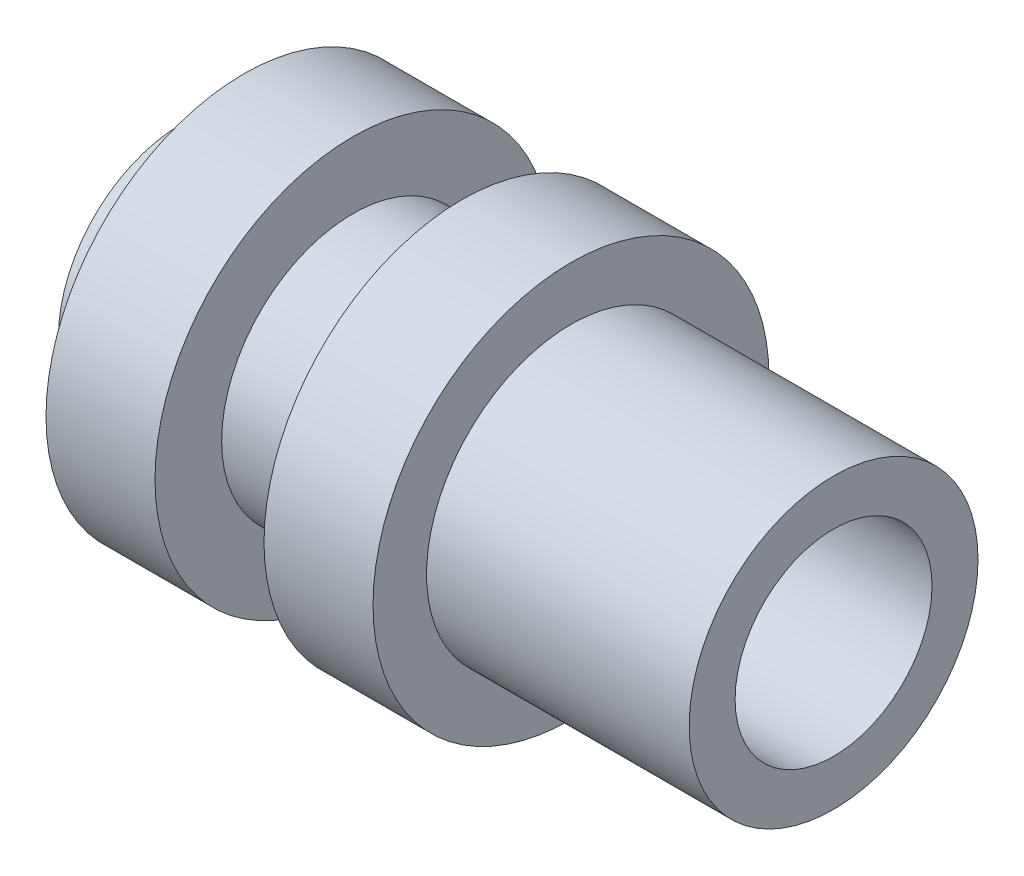
from build123d import *

# Parameters (mm, degrees)
SKETCH1_R           = 15.07617
BOSS_EXTRUDE1_DEPTH = 24.9071592
SKETCH2_R           = 9.3853
SKETCH2_R_2         = 4.5847
BOSS_EXTRUDE2_DEPTH = 4.7498
SKETCH3_R           = 7.5
CUT_EXTRUDE1_DEPTH  = 18.75
BOSS_EXTRUDE3_START = 20
SKETCH4_R           = 11
SKETCH4_R_2         = 7.5
BOSS_EXTRUDE3_DEPTH = 20
CUT_EXTRUDE4_START  = -8.3023864
SKETCH5_R           = 15.07617
SKETCH5_R_2         = 10
CUT_EXTRUDE4_DEPTH  = 8.3023864


with BuildPart() as part:
    # Sketch1 → Boss-Extrude1 (new body)
    with BuildSketch(Plane(origin=(0, 0, 0), x_dir=(0, 0, -1), z_dir=(1, 0, 0))):
        with Locations(Location((0, 0, 0), (0, 0, 180))):
            Circle(SKETCH1_R)
    extrude(amount=BOSS_EXTRUDE1_DEPTH)

    # Sketch2 → Boss-Extrude2 (add)
    with BuildSketch(Plane.ZY):
        with Locations(Location((0, 0, 0), (0, 0, 180))):
            Circle(SKETCH2_R)
        Circle(SKETCH2_R_2, mode=Mode.SUBTRACT)
    extrude(amount=BOSS_EXTRUDE2_DEPTH)

    # Sketch3 → Cut-Extrude1 (cut)
    with BuildSketch(Plane(origin=(24.9071592, 0, 0), x_dir=(0, 0, -1), z_dir=(1, 0, 0))):
        Circle(SKETCH3_R)
    extrude(amount=-CUT_EXTRUDE1_DEPTH, mode=Mode.SUBTRACT)

    # Sketch4 → Boss-Extrude3 (add)
    with BuildSketch(Plane(origin=(24.9071592, 0, 0), x_dir=(0, 0, -1), z_dir=(1, 0, 0)).offset(BOSS_EXTRUDE3_START)):
        Circle(SKETCH4_R)
        Circle(SKETCH4_R_2, mode=Mode.SUBTRACT)
    extrude(amount=-BOSS_EXTRUDE3_DEPTH)

    # Sketch5 → Cut-Extrude4 (cut)
    with BuildSketch(Plane(origin=(16.6047728, 0, 0), x_dir=(0, 0, -1), z_dir=(1, 0, 0)).offset(CUT_EXTRUDE4_START)):
        with Locations(Location((0, 0, 0), (0, 0, 180))):
            Circle(SKETCH5_R)
        Circle(SKETCH5_R_2, mode=Mode.SUBTRACT)
    extrude(amount=CUT_EXTRUDE4_DEPTH, mode=Mode.SUBTRACT)


solid = part.part
